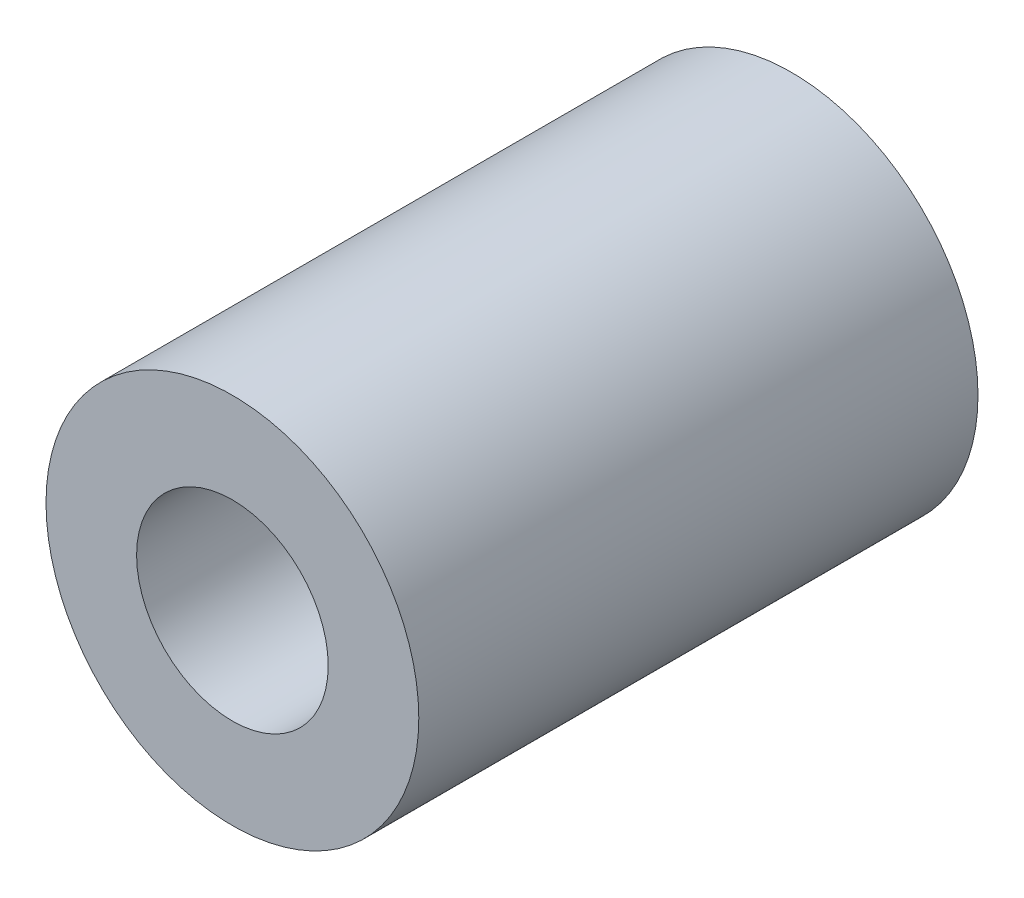
from build123d import *

# Parameters (mm, degrees)
SKETCH1_R           = 6.35
SKETCH1_R_2         = 3.2639
BOSS_EXTRUDE1_DEPTH = 19.05


with BuildPart() as part:
    # Sketch1 → Boss-Extrude1 (new body)
    with BuildSketch(Plane.XY):
        with Locations(Location((0, 0, 0), (0, 0, 180))):
            Circle(SKETCH1_R)
        with Locations(Location((0, 0, 0), (0, 0, 180))):
            Circle(SKETCH1_R_2, mode=Mode.SUBTRACT)
    extrude(amount=BOSS_EXTRUDE1_DEPTH)


solid = part.part
